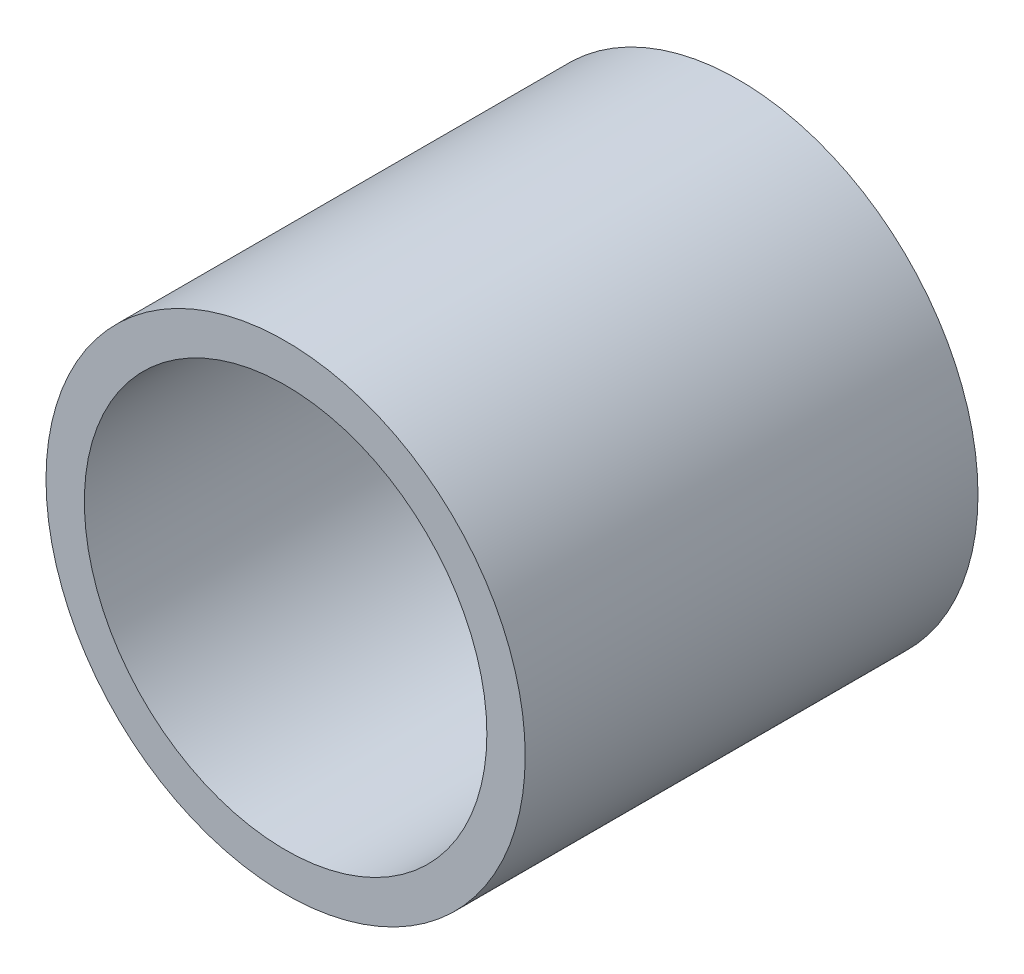
from build123d import *

# Parameters (mm, degrees)
SKETCH1_R           = 3.175
SKETCH1_R_2         = 2.667
BOSS_EXTRUDE1_DEPTH = 6


with BuildPart() as part:
    # Sketch1 → Boss-Extrude1 (new body)
    with BuildSketch(Plane.XY):
        Circle(SKETCH1_R)
        Circle(SKETCH1_R_2, mode=Mode.SUBTRACT)
    extrude(amount=BOSS_EXTRUDE1_DEPTH)


solid = part.part
